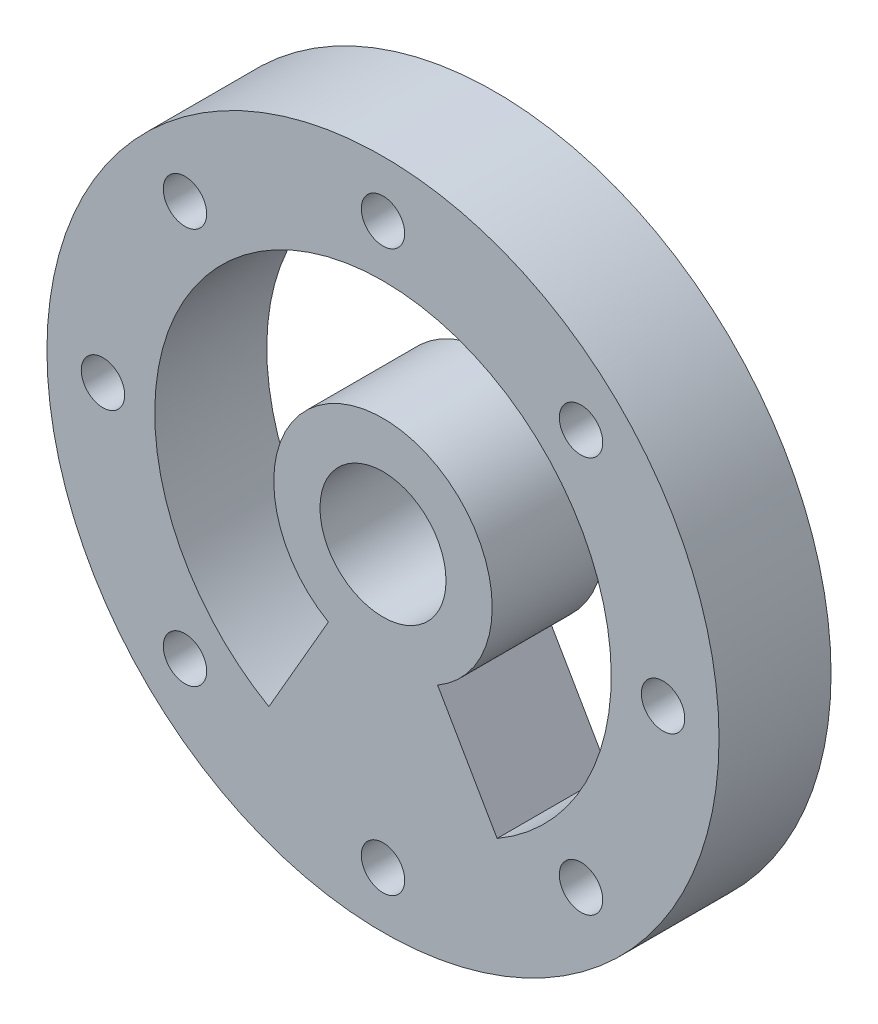
from build123d import *

# Parameters (mm, degrees)
SKETCH6_R           = 24
BOSS_EXTRUDE1_DEPTH = 8
CUT_EXTRUDE4_DEPTH  = 8
SKETCH7_R           = 4.5
CUT_EXTRUDE5_DEPTH  = 8
SKETCH8_R           = 1.55
CUT_EXTRUDE6_DEPTH  = 8


with BuildPart() as part:
    # Sketch6 → Boss-Extrude1 (new body)
    with BuildSketch(Plane.XY):
        Circle(SKETCH6_R)
    extrude(amount=BOSS_EXTRUDE1_DEPTH)

    # Sketch4 → Cut-Extrude4 (cut)
    with BuildSketch(Plane.XY):
        with BuildLine():
            Line((-3.9, -6.75499815), (-8.15, -14.116214082))
            ThreePointArc((-8.15, -14.116214082), (0, 16.3), (8.15, -14.116214082))
            Line((8.15, -14.116214082), (3.9, -6.75499815))
            ThreePointArc((3.9, -6.75499815), (0, 7.8), (-3.9, -6.75499815))
        make_face()
    extrude(amount=CUT_EXTRUDE4_DEPTH, mode=Mode.SUBTRACT)

    # Sketch7 → Cut-Extrude5 (cut)
    with BuildSketch(Plane(origin=(0, 0, 0), x_dir=(-1, 0, 0), z_dir=(0, 0, -1))):
        Circle(SKETCH7_R)
    extrude(amount=-CUT_EXTRUDE5_DEPTH, mode=Mode.SUBTRACT)

    # Sketch8 → Cut-Extrude6 (cut)
    with BuildSketch(Plane(origin=(0, 0, 0), x_dir=(-1, 0, 0), z_dir=(0, 0, -1))):
        with Locations((0, 20)):
            Circle(SKETCH8_R)
        with Locations((14.142135624, 14.142135624)):
            Circle(SKETCH8_R)
        with Locations((20, 0)):
            Circle(SKETCH8_R)
        with Locations((14.142135624, -14.142135624)):
            Circle(SKETCH8_R)
        with Locations((0, -20)):
            Circle(SKETCH8_R)
        with Locations((-14.142135624, -14.142135624)):
            Circle(SKETCH8_R)
        with Locations((-20, 0)):
            Circle(SKETCH8_R)
        with Locations((-14.142135624, 14.142135624)):
            Circle(SKETCH8_R)
    extrude(amount=-CUT_EXTRUDE6_DEPTH, mode=Mode.SUBTRACT)


solid = part.part
